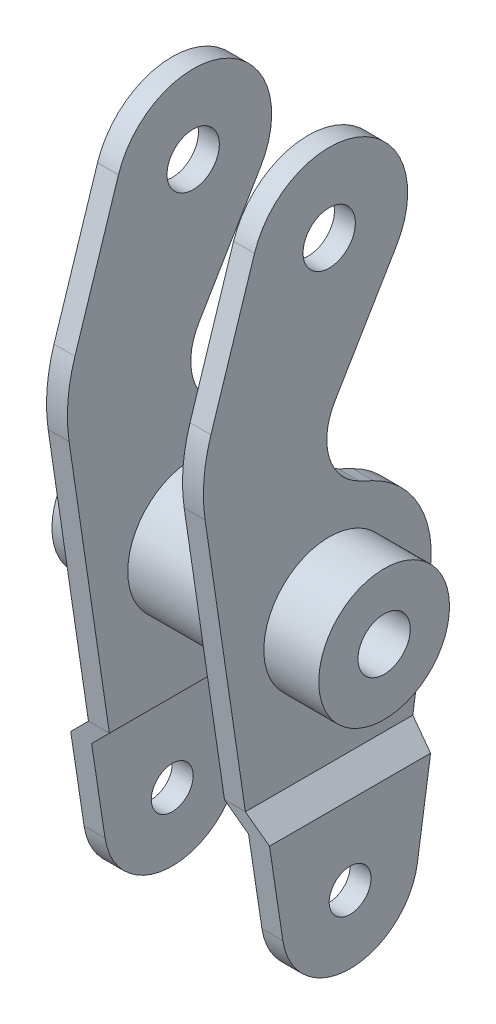
from build123d import *

# Parameters (mm, degrees)
SKETCH_1_R          = 12.5
SKETCH_1_R_2        = 5
EXTRUDE_1_DEPTH     = 25.5
SKETCH_2_R          = 5
SKETCH_2_R_2        = 4
EXTRUDE_2_DEPTH     = 4
SKETCH_3_R          = 4
EXTRUDE_3_DEPTH     = 4
CUT_EXTRUDE_1_DEPTH = 40


with BuildPart() as part:
    # Эскиз1 → Бобышка-Вытянуть1 (new, symmetric)
    with BuildSketch(Plane(origin=(0, 0, 0), x_dir=(0, 0, -1), z_dir=(1, 0, 0))):
        Circle(SKETCH_1_R)
        Circle(SKETCH_1_R_2, mode=Mode.SUBTRACT)
    extrude(amount=EXTRUDE_1_DEPTH, both=True)

    # Эскиз2 → Бобышка-Вытянуть2 (add)
    with BuildSketch(Plane(origin=(11, 0, 0), x_dir=(0, 0, -1), z_dir=(1, 0, 0))):
        with BuildLine():
            Line((19.286048643, -2.880681818), (12.857365762, -45.920454545))
            ThreePointArc((12.857365762, -45.920454545), (0.010828077, -56.99999549), (-12.854148718, -45.94187042))
            Line((-12.854148718, -45.94187042), (-16.017827589, -25))
            Line((-16.017827589, -25), (-23.722142449, 27.142407875))
            ThreePointArc((-23.722142449, 27.142407875), (-23.942938222, 33.992097325), (-22.603459703, 40.713168195))
            Line((-22.603459703, 40.713168195), (-14.279554631, 66.592855272))
            ThreePointArc((-14.279554631, 66.592855272), (6.159605024, 75.676961137), (12.90308202, 54.350786029))
            Line((12.90308202, 54.350786029), (1.079282087, 34.405800714))
            ThreePointArc((1.079282087, 34.405800714), (0.002277121, 25.646156374), (5.709711427, 18.914403089))
            Line((5.709711427, 18.914403089), (8.565518251, 17.518044899))
            ThreePointArc((8.565518251, 17.518044899), (17.261357349, 9.071689063), (19.286048643, -2.880681818))
        make_face()
        Circle(SKETCH_2_R, mode=Mode.SUBTRACT)
        with Locations((0, -44)):
            Circle(SKETCH_2_R_2, mode=Mode.SUBTRACT)
        with Locations((0, 62)):
            Circle(SKETCH_2_R, mode=Mode.SUBTRACT)
    extrude_2 = extrude(amount=EXTRUDE_2_DEPTH)

    # Эскиз3 → Бобышка-Вытянуть3 (add)
    with BuildSketch(Plane(origin=(15, 0, 0), x_dir=(0, 0, -1), z_dir=(1, 0, 0))):
        with BuildLine():
            Line((-16.017827589, -25), (15.982172411, -25))
            Line((15.982172411, -25), (12.857365762, -45.920454545))
            ThreePointArc((12.857365762, -45.920454545), (0.010828077, -56.99999549), (-12.854148718, -45.94187042))
            Line((-12.854148718, -45.94187042), (-16.017827589, -25))
        make_face()
        with Locations((0, -44)):
            Circle(SKETCH_3_R, mode=Mode.SUBTRACT)
    extrude_3 = extrude(amount=EXTRUDE_3_DEPTH)

    # Эскиз5 → Вырез-Вытянуть1 (cut)
    with BuildSketch(Plane.XY.offset(20)):
        Polygon((15, -25), (19, -25), (19, -29), align=None)
        Polygon((15, -57), (15, -29), (11, -25), (11, -57), align=None)
    cut_extrude_1 = extrude(amount=-CUT_EXTRUDE_1_DEPTH, mode=Mode.SUBTRACT)

    # Зеркальное отражение1: Бобышка-Вытянуть2, Бобышка-Вытянуть3, Вырез-Вытянуть1 across plane
    add(extrude_2.mirror(Plane(origin=(0, 0, 0), x_dir=(0, 0, 1), z_dir=(1, 0, 0))))
    add(extrude_3.mirror(Plane(origin=(0, 0, 0), x_dir=(0, 0, 1), z_dir=(1, 0, 0))))
    add(cut_extrude_1.mirror(Plane(origin=(0, 0, 0), x_dir=(0, 0, 1), z_dir=(1, 0, 0))), mode=Mode.SUBTRACT)


solid = part.part
